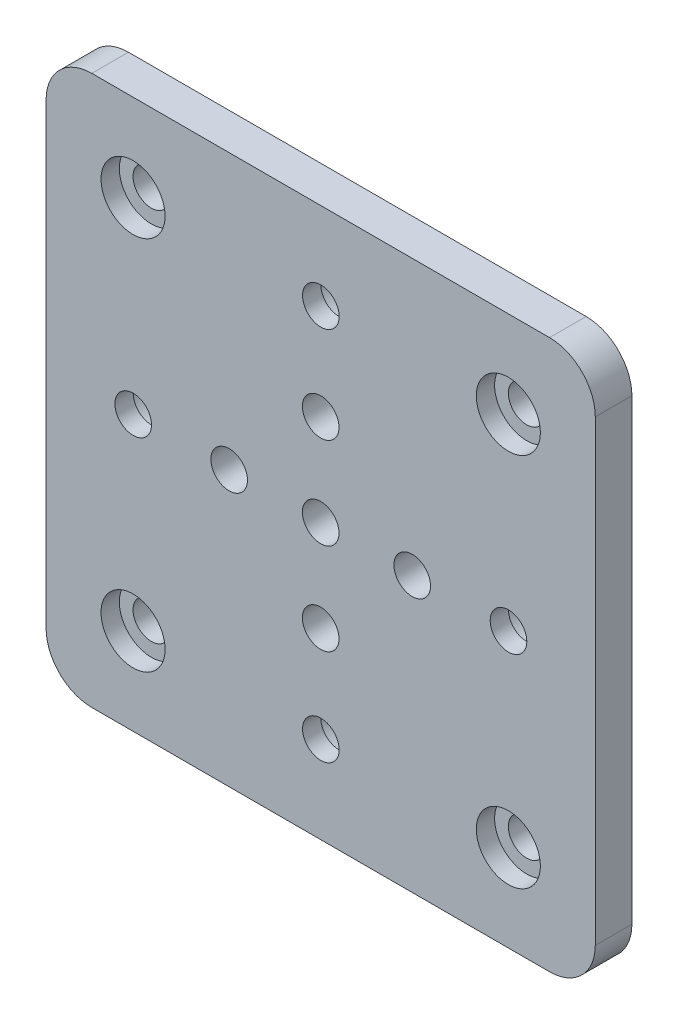
from build123d import *

# Parameters (mm, degrees)
SKETCH1_R           = 2
BOSS_EXTRUDE2_DEPTH = 4
SKETCH2_R           = 3.5
CUT_EXTRUDE1_DEPTH  = 2
SKETCH3_R           = 3.5
CUT_EXTRUDE2_DEPTH  = 2


with BuildPart() as part:
    # Sketch1 → Boss-Extrude2 (new body)
    with BuildSketch(Plane.XY):
        with BuildLine():
            Line((29.982938543, -25.0000071), (29.982938543, 24.9999929))
            ThreePointArc((29.982938543, 24.9999929), (28.518472449, 28.535526806), (24.982938543, 29.9999929))
            Line((24.982938543, 29.9999929), (-25.017061457, 29.9999929))
            ThreePointArc((-25.017061457, 29.9999929), (-28.552595363, 28.535526806), (-30.017061457, 24.9999929))
            Line((-30.017061457, 24.9999929), (-30.017061457, -25.0000071))
            ThreePointArc((-30.017061457, -25.0000071), (-28.552595363, -28.535541006), (-25.017061457, -30.0000071))
            Line((-25.017061457, -30.0000071), (24.982938543, -30.0000071))
            ThreePointArc((24.982938543, -30.0000071), (28.518472449, -28.535541006), (29.982938543, -25.0000071))
        make_face()
        with Locations((-20.517061457, 20.4999929)):
            Circle(SKETCH1_R, mode=Mode.SUBTRACT)
        with Locations((-10.017061457, 0)):
            Circle(SKETCH1_R, mode=Mode.SUBTRACT)
        with Locations((-0.017061457, 0)):
            Circle(SKETCH1_R, mode=Mode.SUBTRACT)
        with Locations(Location((20.482938543, -20.5000071, 0), (0, 0, 180))):
            Circle(SKETCH1_R, mode=Mode.SUBTRACT)
        with Locations((0, 20.4999929)):
            Circle(SKETCH1_R, mode=Mode.SUBTRACT)
        with Locations((20.482938543, 20.4999929)):
            Circle(SKETCH1_R, mode=Mode.SUBTRACT)
        with Locations(Location((-20.517061457, -20.5000071, 0), (0, 0, 180))):
            Circle(SKETCH1_R, mode=Mode.SUBTRACT)
        with Locations((-0.017061457, 10)):
            Circle(SKETCH1_R, mode=Mode.SUBTRACT)
        with Locations((9.982938543, 0)):
            Circle(SKETCH1_R, mode=Mode.SUBTRACT)
        with Locations((-0.017061457, -10)):
            Circle(SKETCH1_R, mode=Mode.SUBTRACT)
        with Locations((20.5000071, 0)):
            Circle(SKETCH1_R, mode=Mode.SUBTRACT)
        with Locations((0, -20.5000071)):
            Circle(SKETCH1_R, mode=Mode.SUBTRACT)
        with Locations((-20.5, 0)):
            Circle(SKETCH1_R, mode=Mode.SUBTRACT)
    extrude(amount=BOSS_EXTRUDE2_DEPTH)

    # Sketch2 → Cut-Extrude1 (cut)
    with BuildSketch(Plane.XY.offset(4)):
        with Locations((-20.517061457, 20.4999929)):
            Circle(SKETCH2_R)
        with Locations((-20.517061457, -20.5000071)):
            Circle(SKETCH2_R)
        with Locations((20.482938543, -20.5000071)):
            Circle(SKETCH2_R)
        with Locations((20.482938543, 20.4999929)):
            Circle(SKETCH2_R)
    extrude(amount=-CUT_EXTRUDE1_DEPTH, mode=Mode.SUBTRACT)

    # Sketch3 → Cut-Extrude2 (cut)
    with BuildSketch(Plane(origin=(0, 0, 0), x_dir=(-1, 0, 0), z_dir=(0, 0, -1))):
        with Locations((-20.5000071, 0)):
            Circle(SKETCH3_R)
        with Locations((20.5, 0)):
            Circle(SKETCH3_R)
        with Locations((0, 20.4999929)):
            Circle(SKETCH3_R)
        with Locations((0, -20.5000071)):
            Circle(SKETCH3_R)
    extrude(amount=-CUT_EXTRUDE2_DEPTH, mode=Mode.SUBTRACT)


solid = part.part
